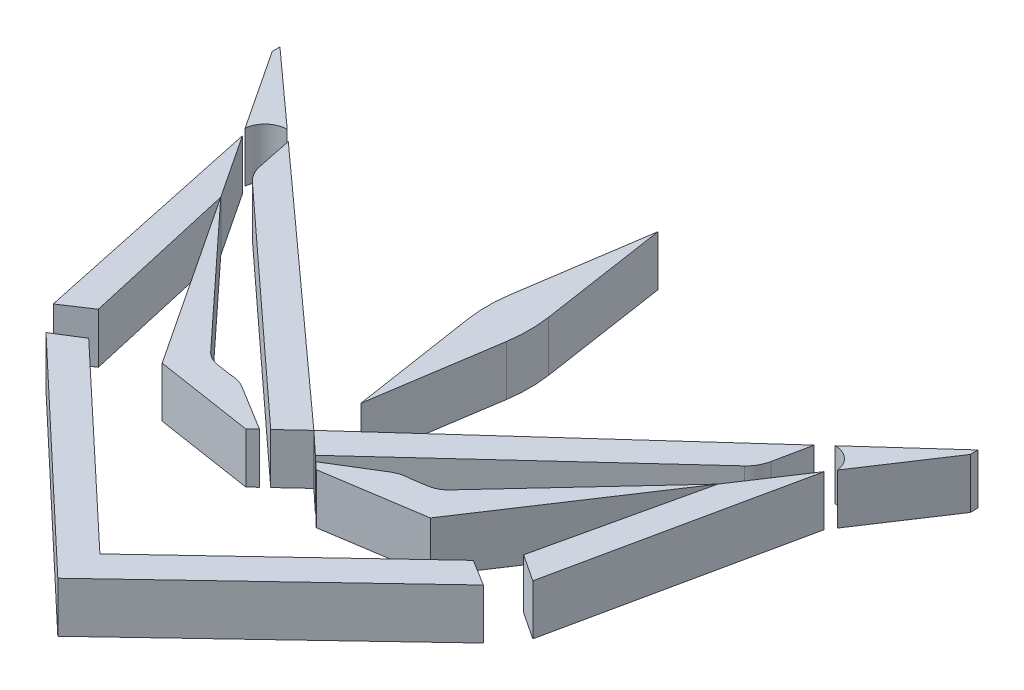
from build123d import *

# Parameters (mm, degrees)
BOSS_EXTRUDE1_DEPTH = 10


with BuildPart() as part:
    # Sketch1 → Boss-Extrude1 (new body)
    with BuildSketch(Plane(origin=(0, 0, 0), x_dir=(1, 0, 0), z_dir=(0, 1, 0))):
        with BuildLine():
            Line((-38.80180608, 107.061199976), (-34.358321309, 111.202312229))
            Line((-34.358321309, 111.202312229), (-86.645351215, 158.405295793))
            Line((-86.645351215, 158.405295793), (-85.174816603, 151.271524399))
            ThreePointArc((-85.174816603, 151.271524399), (-84.49600208, 149.448444582), (-83.299059708, 147.914906799))
            Line((-83.299059708, 147.914906799), (-38.80180608, 107.061199976))
        make_face()
        with BuildLine():
            ThreePointArc((-93.259871061, 156.441713091), (-91.80845524, 159.259552882), (-88.849013307, 160.3946883))
            Line((-88.849013307, 160.3946883), (-103.770558364, 173.865360612))
            Line((-103.770558364, 173.865360612), (-103.770558364, 172.332135816))
            Line((-103.770558364, 172.332135816), (-93.259871061, 156.441713091))
        make_face()
        with BuildLine():
            Line((-41.36570241, 104.671772971), (-39.954323301, 105.987109835))
            Line((-39.954323301, 105.987109835), (-48.989329139, 111.538283499))
            ThreePointArc((-48.989329139, 111.538283499), (-50.593338483, 112.241564878), (-52.328165313, 112.482036388))
            Line((-52.328165313, 112.482036388), (-55.25998468, 112.947419576))
            ThreePointArc((-55.25998468, 112.947419576), (-56.71778726, 113.411069709), (-57.972571628, 114.286098849))
            Line((-57.972571628, 114.286098849), (-83.775548308, 142.102984))
            Line((-83.775548308, 142.102984), (-61.019880213, 107.700173319))
            Line((-61.019880213, 107.700173319), (-41.36570241, 104.671772971))
        make_face()
        Polygon((-83.775548308, 142.102984), (-92.202313911, 154.8428614), (-82.042161158, 107.061199976), (-76.648185291, 110.629034176), align=None)
        Polygon((-34.358321309, 60.280395364), (-34.358321309, 68.649296695), (-72.607617289, 104.671772971), (-77.841407623, 101.415785755), align=None)
        Polygon((3.89097467, 104.671772971), (-34.358321309, 68.649296695), (-34.358321309, 60.280395364), (9.124765004, 101.415785755), align=None)
        Polygon((13.325518539, 107.061199976), (23.485671292, 154.8428614), (15.058905689, 142.102984), (7.931542673, 110.629034176), align=None)
        with BuildLine():
            Line((35.053915745, 173.865360612), (20.132370689, 160.3946883))
            ThreePointArc((20.132370689, 160.3946883), (23.091812622, 159.259552882), (24.543228442, 156.441713091))
            Line((24.543228442, 156.441713091), (35.053915745, 172.332135816))
            Line((35.053915745, 172.332135816), (35.053915745, 173.865360612))
        make_face()
        with BuildLine():
            Line((17.928708597, 158.405295793), (-34.358321309, 111.202312229))
            Line((-34.358321309, 111.202312229), (-29.914836539, 107.061199976))
            Line((-29.914836539, 107.061199976), (14.58241709, 147.914906799))
            ThreePointArc((14.58241709, 147.914906799), (15.779359461, 149.448444582), (16.458173984, 151.271524399))
            Line((16.458173984, 151.271524399), (17.928708597, 158.405295793))
        make_face()
        with BuildLine():
            Line((-19.72731348, 111.538283499), (-28.762319318, 105.987109835))
            Line((-28.762319318, 105.987109835), (-27.350940209, 104.671772971))
            Line((-27.350940209, 104.671772971), (-7.696762406, 107.700173319))
            Line((-7.696762406, 107.700173319), (15.058905689, 142.102984))
            Line((15.058905689, 142.102984), (-10.744070991, 114.286098849))
            ThreePointArc((-10.744070991, 114.286098849), (-11.998855359, 113.411069709), (-13.456657938, 112.947419576))
            Line((-13.456657938, 112.947419576), (-16.388477306, 112.482036388))
            ThreePointArc((-16.388477306, 112.482036388), (-18.123304135, 112.241564878), (-19.72731348, 111.538283499))
        make_face()
        with BuildLine():
            ThreePointArc((-30.502017254, 154.03074681), (-30.191123443, 149.843448403), (-30.513157693, 145.656992043))
            Line((-30.513157693, 145.656992043), (-34.358321309, 120.590655623))
            Line((-34.358321309, 120.590655623), (-34.358321309, 179.623895831))
            Line((-34.358321309, 179.623895831), (-30.502017254, 154.03074681))
        make_face()
        with BuildLine():
            Line((-34.358321309, 179.623895831), (-38.214625364, 154.03074681))
            ThreePointArc((-38.214625364, 154.03074681), (-38.525519176, 149.843448403), (-38.203484926, 145.656992043))
            Line((-38.203484926, 145.656992043), (-34.358321309, 120.590655623))
            Line((-34.358321309, 120.590655623), (-34.358321309, 179.623895831))
        make_face()
    extrude(amount=BOSS_EXTRUDE1_DEPTH)


solid = part.part
